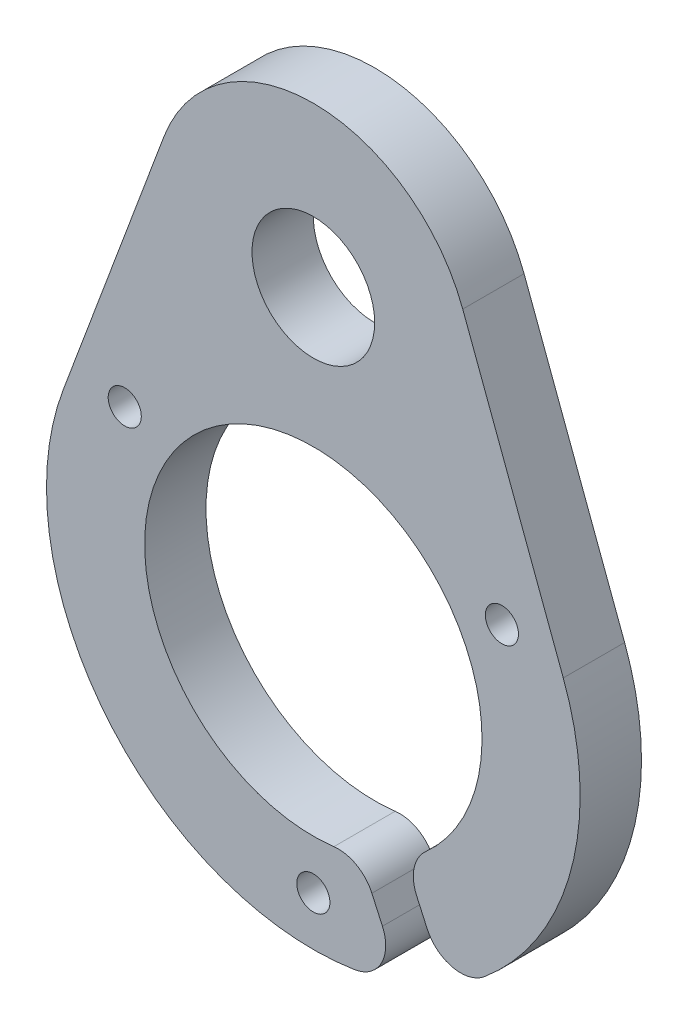
from build123d import *

# Parameters (mm, degrees)
SKETCH1_R           = 5
SKETCH1_R_2         = 1.35
BOSS_EXTRUDE1_DEPTH = 5
CONG_2_R            = 3


with BuildPart() as part:
    # Sketch1 → Boss-Extrude1 (new body)
    with BuildSketch(Plane.XY):
        with BuildLine():
            Line((7.433976594, -11.567129808), (10.756607468, -18.903912182))
            ThreePointArc((10.756607468, -18.903912182), (20.44660049, -7.416132981), (20.37430597, 7.6125))
            Line((20.37430597, 7.6125), (12.177746097, 29.55))
            ThreePointArc((12.177746097, 29.55), (0, 38), (-12.177746097, 29.55))
            Line((-12.177746097, 29.55), (-20.37430597, 7.6125))
            ThreePointArc((-20.37430597, 7.6125), (-15.56616527, -15.190687897), (7.112849411, -20.554071939))
            Line((7.112849411, -20.554071939), (3.790218537, -13.217289565))
            ThreePointArc((3.790218537, -13.217289565), (-5.672424163, 12.525418321), (7.433976594, -11.567129808))
        make_face()
        with Locations((0, 25)):
            Circle(SKETCH1_R, mode=Mode.SUBTRACT)
        with Locations((0, -17.75)):
            Circle(SKETCH1_R_2, mode=Mode.SUBTRACT)
        with Locations((15.371950917, 8.875)):
            Circle(SKETCH1_R_2, mode=Mode.SUBTRACT)
        with Locations((-15.371950917, 8.875)):
            Circle(SKETCH1_R_2, mode=Mode.SUBTRACT)
    extrude(amount=BOSS_EXTRUDE1_DEPTH)

    # Congé2
    cong_2_edges = [part.edges().sort_by_distance(p)[0] for p in [
        (3.790218537, -13.217289565, 2.5),
        (7.112849411, -20.554071939, 2.5),
        (10.756607468, -18.903912182, 2.5),
        (7.433976594, -11.567129808, 2.5),
    ]]
    fillet(cong_2_edges, radius=CONG_2_R)


solid = part.part
